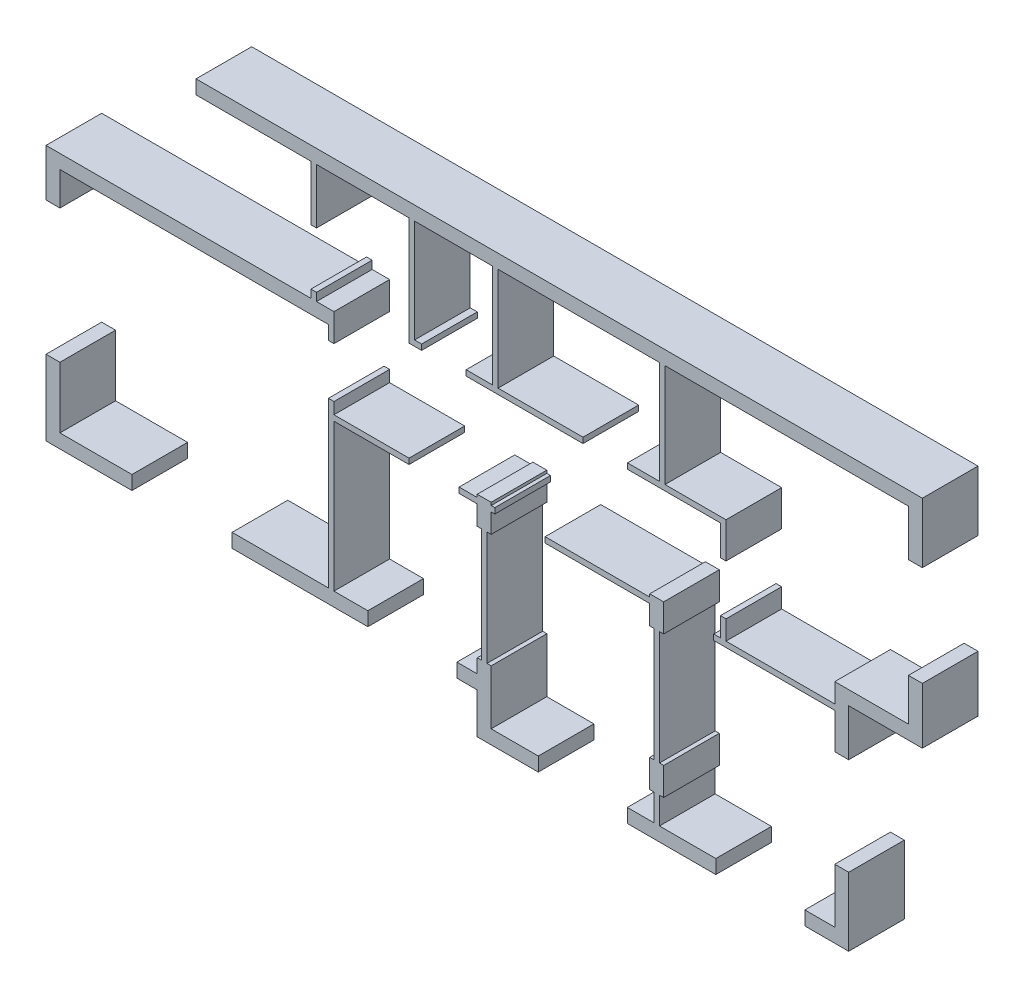
from build123d import *

# Parameters (mm, degrees)
BOSS_EXTRUDE1_DEPTH   = 10
BOSS_EXTRUDE1_2_DEPTH = 10
BOSS_EXTRUDE1_3_DEPTH = 10
BOSS_EXTRUDE1_4_DEPTH = 10
BOSS_EXTRUDE1_5_DEPTH = 10
BOSS_EXTRUDE1_6_DEPTH = 10
BOSS_EXTRUDE1_7_DEPTH = 10
BOSS_EXTRUDE1_8_DEPTH = 10


with BuildPart() as part:
    # Sketch2 → Boss-Extrude1 (new body)
    with BuildSketch(Plane.XY):
        Polygon((1.25, 42.25), (49.5, 42.25), (49.5, 39.76289584), (50.5, 39.76289584), (50.5, 44.75), (47.364305552, 44.75), (47.364305552, 46.195174047), (46.364305552, 46.195174047), (46.364305552, 44.75), (-1.25, 44.75), (-1.25, 36.246112635), (1.25, 36.246112635), align=None)
    extrude(amount=BOSS_EXTRUDE1_DEPTH)


with BuildPart() as body_2:
    # Sketch2 → Boss-Extrude1 2 (new body)
    with BuildSketch(Plane.XY):
        Polygon((-1.25, 12.246112635), (-1.25, -1.25), (14.194440447, -1.25), (14.194440447, 1.25), (1.25, 1.25), (1.25, 12.246112635), align=None)
    extrude(amount=BOSS_EXTRUDE1_2_DEPTH)


with BuildPart() as body_3:
    # Sketch2 → Boss-Extrude1 3 (new body)
    with BuildSketch(Plane.XY):
        Polygon((56.590450533, 1.25), (50.5, 1.25), (50.5, 27.697429853), (63.990459014, 27.697429853), (63.990459014, 28.697429853), (50.5, 28.697429853), (50.5, 30.76289584), (49.5, 30.76289584), (49.5, 1.25), (32.194440447, 1.25), (32.194440447, -1.25), (56.590450533, -1.25), align=None)
    extrude(amount=BOSS_EXTRUDE1_3_DEPTH)


with BuildPart() as body_4:
    # Sketch2 → Boss-Extrude1 4 (new body)
    with BuildSketch(Plane.XY):
        Polygon((72.590450533, -1.25), (76.25, -1.25), (76.25, -8.552570147), (87.217668521, -8.552570147), (87.217668521, -6.052570147), (78.75, -6.052570147), (78.75, 3.75), (78, 3.75), (78, 24.206591876), (78.75, 24.206591876), (78.75, 27.697429853), (79.401701652, 27.697429853), (79.401701652, 28.697429853), (78.75, 28.697429853), (78.75, 29.206591876), (76.25, 29.206591876), (76.25, 28.697429853), (72.990459014, 28.697429853), (72.990459014, 27.697429853), (76.25, 27.697429853), (76.25, 24.206591876), (77, 24.206591876), (77, 3.75), (76.25, 3.75), (76.25, 1.25), (72.590450533, 1.25), align=None)
    extrude(amount=BOSS_EXTRUDE1_4_DEPTH)


with BuildPart() as body_5:
    # Sketch2 → Boss-Extrude1 5 (new body)
    with BuildSketch(Plane.XY):
        Polygon((119.121020592, -6.052570147), (109, -6.052570147), (109, -1.25), (109.75, -1.25), (109.75, 3.75), (109, 3.75), (109, 24.206591876), (109.75, 24.206591876), (109.75, 29.206591876), (107.25, 29.206591876), (107.25, 28.697429853), (88.442866465, 28.697429853), (88.442866465, 27.697429853), (107.25, 27.697429853), (107.25, 24.206591876), (108, 24.206591876), (108, 3.75), (107.25, 3.75), (107.25, -1.25), (108, -1.25), (108, -6.052570147), (103.217668521, -6.052570147), (103.217668521, -8.552570147), (119.121020592, -8.552570147), align=None)
    extrude(amount=BOSS_EXTRUDE1_5_DEPTH)


with BuildPart() as body_6:
    # Sketch2 → Boss-Extrude1 6 (new body)
    with BuildSketch(Plane.XY):
        Polygon((135.121020592, -8.552570147), (143, -8.552570147), (143, 3.75), (140.5, 3.75), (140.5, -6.052570147), (135.121020592, -6.052570147), align=None)
    extrude(amount=BOSS_EXTRUDE1_6_DEPTH)


with BuildPart() as body_7:
    # Sketch2 → Boss-Extrude1 7 (new body)
    with BuildSketch(Plane.XY):
        Polygon((140.5, 32.169046535), (140.5, 28.697429853), (120.953268871, 28.697429853), (120.953268871, 32.163060598), (119.953268871, 32.163060598), (119.953268871, 28.697429853), (118.75, 28.697429853), (118.75, 27.697429853), (140.5, 27.697429853), (140.5, 21.25), (143, 21.25), (143, 29.669046535), (156.240459014, 29.669046535), (156.240459014, 39.76289584), (153.740459014, 39.76289584), (153.740459014, 32.169046535), align=None)
    extrude(amount=BOSS_EXTRUDE1_7_DEPTH)


with BuildPart() as body_8:
    # Sketch2 → Boss-Extrude1 8 (new body)
    with BuildSketch(Plane.XY):
        Polygon((156.240459014, 68.58761226), (25.71255602, 68.58761226), (25.71255602, 66.08761226), (46.364305552, 66.08761226), (46.364305552, 56.195174047), (47.364305552, 56.195174047), (47.364305552, 66.08761226), (63.990459014, 66.08761226), (63.990459014, 46.58761226), (66.252757915, 46.58761226), (66.252757915, 47.58761226), (64.990459014, 47.58761226), (64.990459014, 66.08761226), (78.990459014, 66.08761226), (78.990459014, 47.58761226), (74.252757915, 47.58761226), (74.252757915, 46.58761226), (95.252902041, 46.58761226), (95.252902041, 47.58761226), (79.990459014, 47.58761226), (79.990459014, 66.08761226), (108.990459014, 66.08761226), (108.990459014, 47.58761226), (103.252902041, 47.58761226), (103.252902041, 46.58761226), (119.953268871, 46.58761226), (119.953268871, 41.163060598), (120.953268871, 41.163060598), (120.953268871, 47.58761226), (109.990459014, 47.58761226), (109.990459014, 66.08761226), (153.740459014, 66.08761226), (153.740459014, 57.76289584), (156.240459014, 57.76289584), align=None)
    extrude(amount=BOSS_EXTRUDE1_8_DEPTH)


solid = Compound([part.part, body_2.part, body_3.part, body_4.part, body_5.part, body_6.part, body_7.part, body_8.part])
